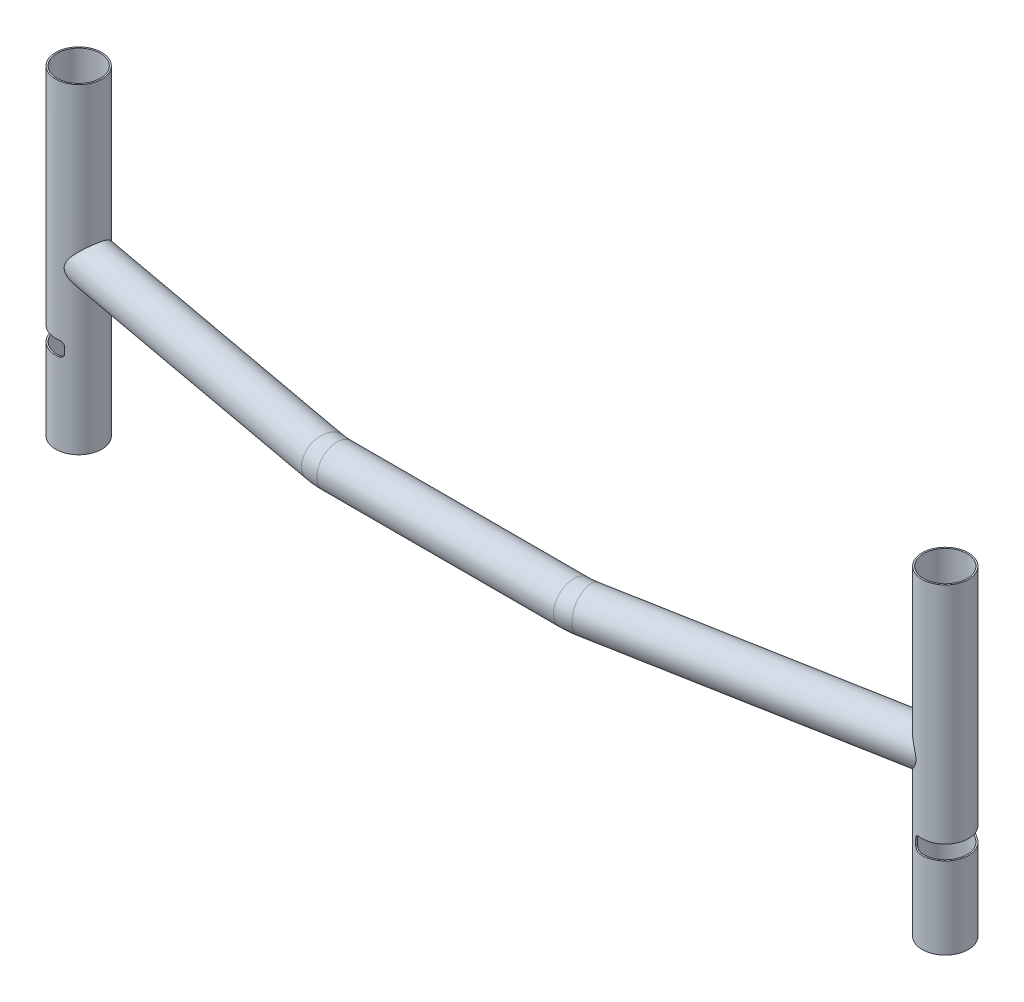
from build123d import *

# Parameters (mm, degrees)
SKETCH2_R           = 11.1
SKETCH2_R_2         = 10.3
SKETCH3_R           = 12.7
SKETCH3_R_2         = 11.9
BOSS_EXTRUDE1_DEPTH = 88
SKETCH4_R           = 11.9
CUT_EXTRUDE1_DEPTH  = 310.344523999
SKETCH5_R           = 10.7
CUT_EXTRUDE2_DEPTH  = 88
CUT_EXTRUDE3_DEPTH  = 20
CUT_EXTRUDE4_REACH  = 271.188
SKETCH8_R           = 3


with BuildPart() as part:
    # Sweep1: sweep along a path in Sketch1
    with BuildLine(Plane(origin=(0, 0, 0), x_dir=(1, 0, 0), z_dir=(0, 1, 0))) as sweep1_path:
        Line((232, 30), (72.22502534, 0.657923176))
        ThreePointArc((72.22502534, 0.657923176), (68.627459651, 0.164820366), (65, 0))
        Line((65, 0), (-65, 0))
        ThreePointArc((-65, 0), (-68.627459651, 0.164820366), (-72.22502534, 0.657923176))
        Line((-72.22502534, 0.657923176), (-232, 30))
    # Sketch2 → Sweep1 (sweep)
    with BuildSketch(Plane(origin=(232, 0, -30), x_dir=(-0.18062563349676417, 0, -0.9835519206040384), z_dir=(0.9835519206040384, 0, -0.18062563349676417))):
        Circle(SKETCH2_R)
        Circle(SKETCH2_R_2, mode=Mode.SUBTRACT)
    sweep(path=sweep1_path.line)

    # Sketch3 → Boss-Extrude1 (add, symmetric)
    with BuildSketch(Plane(origin=(0, 0, 0), x_dir=(1, 0, 0), z_dir=(0, 1, 0))):
        with Locations((237.901311524, 31.083753801)):
            Circle(SKETCH3_R)
        with Locations((237.901311524, 31.083753801)):
            Circle(SKETCH3_R_2, mode=Mode.SUBTRACT)
    boss_extrude1 = extrude(amount=BOSS_EXTRUDE1_DEPTH, both=True)

    # Sketch4 → Cut-Extrude1 (cut, through all)
    with BuildSketch(Plane.XZ.offset(88)):
        with Locations((237.901311524, -31.083753801)):
            Circle(SKETCH4_R)
    cut_extrude1 = extrude(amount=-CUT_EXTRUDE1_DEPTH, mode=Mode.SUBTRACT)

    # Sketch5 → Cut-Extrude2 (cut)
    with BuildSketch(Plane(origin=(232, 0, -30), x_dir=(-0.18062563349676417, 0, -0.9835519206040384), z_dir=(0.9835519206040384, 0, -0.18062563349676417))):
        with Locations((-0.014888445, 0)):
            Circle(SKETCH5_R)
    cut_extrude2 = extrude(amount=-CUT_EXTRUDE2_DEPTH, mode=Mode.SUBTRACT)

    # Sketch7 → Cut-Extrude3 (cut, symmetric)
    with BuildSketch(Plane(origin=(237.901311524, 88, -31.083753801), x_dir=(-0.9420937659324533, 0, -0.3353495731191677), z_dir=(0.33534957311916763, 0, -0.9420937659324532))):
        with BuildLine():
            Line((-2.5, -123.230571249), (-12.7, -123.230571249))
            Line((-12.7, -123.230571249), (-12.7, -131.230571249))
            Line((-12.7, -131.230571249), (-2.5, -131.230571249))
            ThreePointArc((-2.5, -131.230571249), (-0.732233047, -130.498338202), (0, -128.730571249))
            Line((0, -128.730571249), (0, -125.730571249))
            ThreePointArc((0, -125.730571249), (-0.732233047, -123.962804296), (-2.5, -123.230571249))
        make_face()
    cut_extrude3 = extrude(amount=CUT_EXTRUDE3_DEPTH, both=True, mode=Mode.SUBTRACT)

    # Mirror1: Boss-Extrude1, Cut-Extrude1, Cut-Extrude2, Cut-Extrude3 across plane
    add(boss_extrude1.mirror(Plane(origin=(0, 0, 0), x_dir=(0, 0, 1), z_dir=(1, 0, 0))))
    add(cut_extrude1.mirror(Plane(origin=(0, 0, 0), x_dir=(0, 0, 1), z_dir=(1, 0, 0))), mode=Mode.SUBTRACT)
    add(cut_extrude2.mirror(Plane(origin=(0, 0, 0), x_dir=(0, 0, 1), z_dir=(1, 0, 0))), mode=Mode.SUBTRACT)
    add(cut_extrude3.mirror(Plane(origin=(0, 0, 0), x_dir=(0, 0, 1), z_dir=(1, 0, 0))), mode=Mode.SUBTRACT)

    # Sketch8 → Cut-Extrude4 (cut, up to next)
    with BuildSketch(Plane(origin=(0, 0, 0), x_dir=(1, 0, 0), z_dir=(0, 1, 0)), mode=Mode.PRIVATE) as cut_extrude4_sk1:
        with Locations((216.987516382, 26.593661315)):
            Circle(SKETCH8_R)
    cut_extrude4_tool1 = extrude(cut_extrude4_sk1.sketch, amount=-CUT_EXTRUDE4_REACH, mode=Mode.PRIVATE) & part.part
    add(cut_extrude4_tool1.solids().sort_by_distance((216.987516, 0, -26.593661))[0], mode=Mode.SUBTRACT)


solid = part.part
